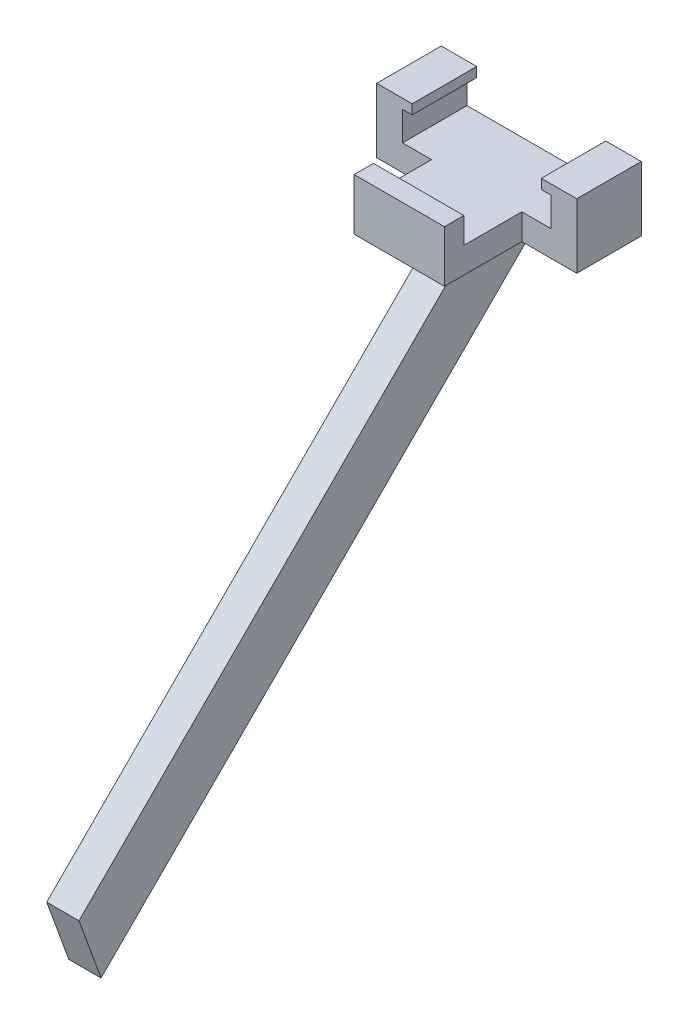
from build123d import *

# Parameters (mm, degrees)
BOSS_EXTRUDE1_DEPTH  = 10
BOSS_EXTRUDE2_DEPTH  = 2.5
SKETCH9_W            = 14
SKETCH9_H            = 9
BOSS_EXTRUDE11_DEPTH = 4
SKETCH10_W           = 14
SKETCH10_H           = 8
BOSS_EXTRUDE12_DEPTH = 3


with BuildPart() as part:
    # Sketch1 → Boss-Extrude1 (new body)
    with BuildSketch(Plane.XY):
        Polygon((0, 1), (0, 0), (0, -9), (15.5, -9), (15.5, -5), (4, -5), (4, -0.5), (5.5, -0.5), (5.5, 1), align=None)
        Polygon((15.5, -5), (15.5, -9), (31, -9), (31, 0), (31, 1), (25.5, 1), (25.5, -0.5), (27, -0.5), (27, -5), align=None)
    extrude(amount=BOSS_EXTRUDE1_DEPTH)

    # Sketch2 → Boss-Extrude2 (add, symmetric)
    with BuildSketch(Plane.ZY.offset(-15.5)):
        Polygon((0, -9), (70.710678119, -79.710678119), (74.130879552, -70.313751911), (12.817127641, -9), align=None)
    extrude(amount=BOSS_EXTRUDE2_DEPTH, both=True)

    # Sketch9 → Boss-Extrude11 (add)
    with BuildSketch(Plane(origin=(0, -9, 0), x_dir=(1, 0, 0), z_dir=(0, 1, 0))):
        with Locations((15.5, -14.5)):
            Rectangle(SKETCH9_W, SKETCH9_H)
    extrude(amount=BOSS_EXTRUDE11_DEPTH)

    # Sketch10 → Boss-Extrude12 (add)
    with BuildSketch(Plane.XY.offset(19)):
        with Locations((15.5, -5)):
            Rectangle(SKETCH10_W, SKETCH10_H)
    extrude(amount=BOSS_EXTRUDE12_DEPTH)


solid = part.part
